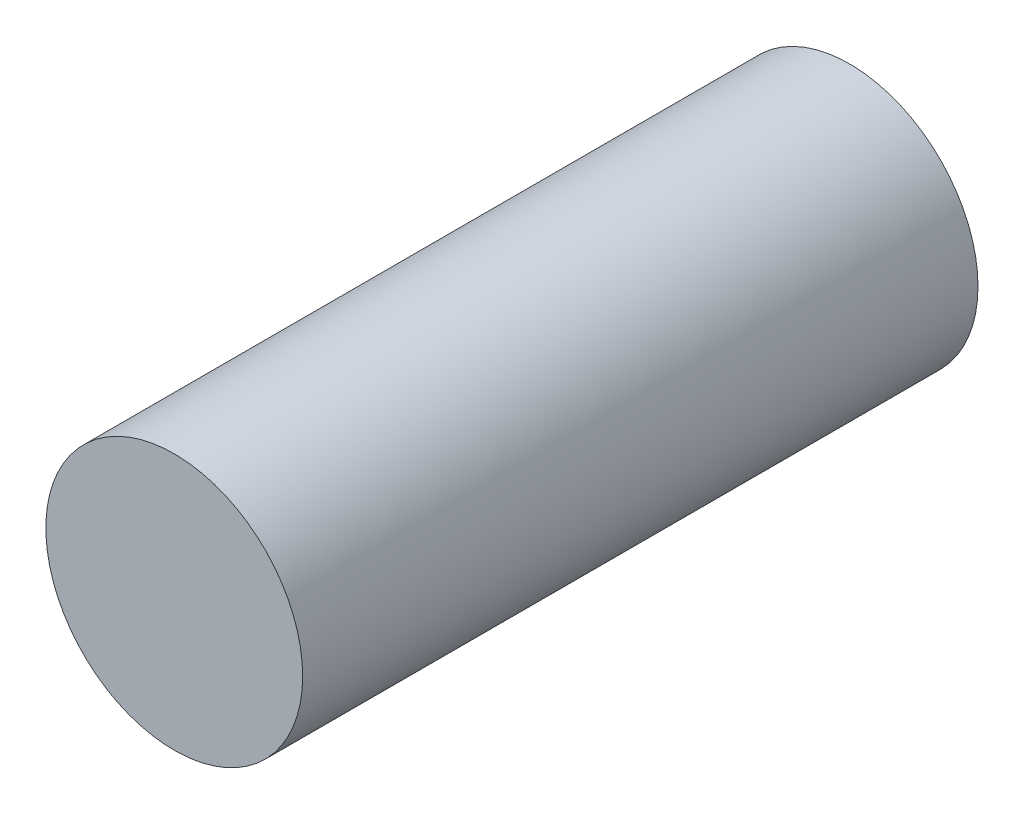
from build123d import *

# Parameters (mm, degrees)
SKETCH1_R           = 1.7145
BOSS_EXTRUDE1_DEPTH = 9.017


with BuildPart() as part:
    # Sketch1 → Boss-Extrude1 (new body)
    with BuildSketch(Plane.XY):
        Circle(SKETCH1_R)
    extrude(amount=BOSS_EXTRUDE1_DEPTH)


solid = part.part
